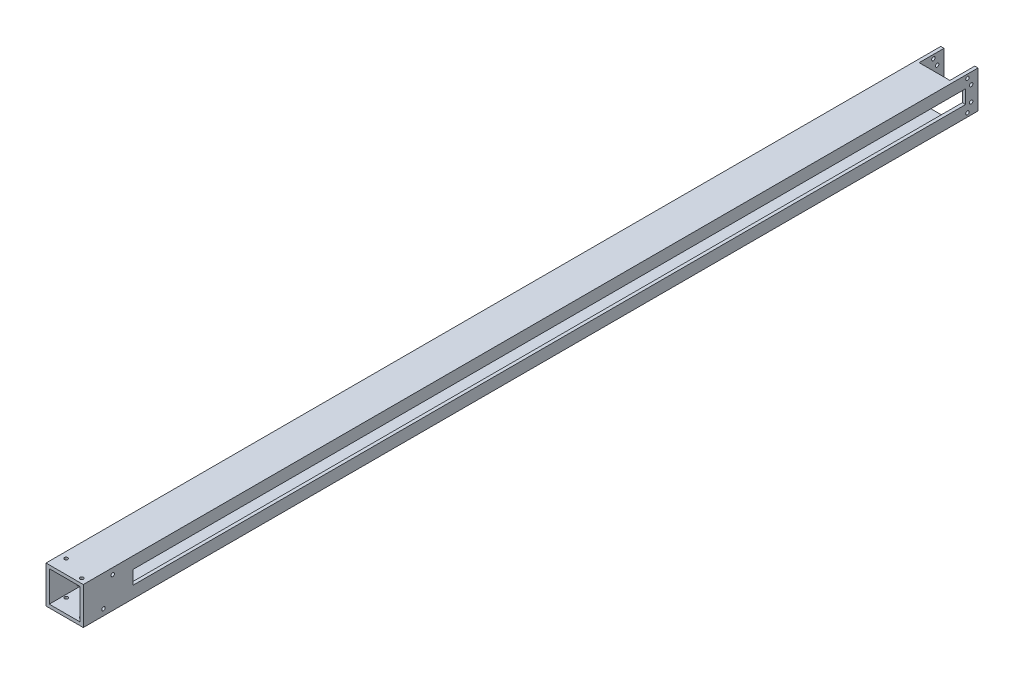
from build123d import *

# Parameters (mm, degrees)
BOSS_EXTRUDE1_DEPTH     = 914.4
CUT_EXTRUDE2_DEPTH      = 70.104
CUT_EXTRUDE2_DEPTH_BACK = 58.42
SKETCH7_R               = 1.75
SKETCH8_W               = 31.4325
SKETCH8_H               = 50.8
CUT_EXTRUDE3_DEPTH      = 71.882
SKETCH10_R              = 1.75
CUT_EXTRUDE5_DEPTH      = 12.7
SKETCH11_W              = 13.97
SKETCH11_H              = 12.7
BOSS_EXTRUDE2_DEPTH     = 3.33375
SKETCH9_R               = 1.75
CUT_EXTRUDE4_DEPTH      = 68.326
CIRPATTERN1_COUNT       = 2
SKETCH12_W              = 38.1
SKETCH12_H              = 50.8
SKETCH12_R              = 1.75
BOSS_EXTRUDE3_DEPTH     = 3.33375


with BuildPart() as part:
    # Sketch1 → Boss-Extrude1 (new body)
    with BuildSketch(Plane(origin=(0, 0, 0), x_dir=(0, 1, 0), z_dir=(0, 0, 1))):
        Polygon((6.985, -19.05), (19.05, -19.05), (19.05, 19.05), (-19.05, 19.05), (-19.05, -19.05), (-6.985, -19.05), (-6.985, -15.71625), (-15.71625, -15.71625), (-15.71625, 15.71625), (15.71625, 15.71625), (15.71625, -15.71625), (6.985, -15.71625), align=None)
    extrude(amount=BOSS_EXTRUDE1_DEPTH)

    # Sketch7 → Cut-Extrude2 (cut, two sides: drawn at the far end of the back side and taken through both)
    with BuildSketch(Plane(origin=(0, 0, 0), x_dir=(-1, 0, 0), z_dir=(0, 1, 0)).offset(-CUT_EXTRUDE2_DEPTH_BACK)):
        with Locations(Location((-12.7, 909.6375, 0), (0, 0, 270))):
            Circle(SKETCH7_R)
        with Locations(Location((12.7, 900.1125, 0), (0, 0, 270))):
            Circle(SKETCH7_R)
    extrude(amount=CUT_EXTRUDE2_DEPTH + CUT_EXTRUDE2_DEPTH_BACK, mode=Mode.SUBTRACT)

    # Sketch8 → Cut-Extrude3 (cut)
    with BuildSketch(Plane(origin=(0, 19.05, 0), x_dir=(-1, 0, 0), z_dir=(0, 1, 0))):
        Rectangle(SKETCH8_W, SKETCH8_H)
    extrude(amount=-CUT_EXTRUDE3_DEPTH, mode=Mode.SUBTRACT)

    # Sketch10 → Cut-Extrude5 (cut)
    with BuildSketch(Plane.YZ.offset(19.05)):
        with Locations((-12.7, 893.7625)):
            Circle(SKETCH10_R)
        with Locations((12.7, 884.2375)):
            Circle(SKETCH10_R)
    cut_extrude5 = extrude(amount=-CUT_EXTRUDE5_DEPTH, mode=Mode.SUBTRACT)

    # Sketch11 → Boss-Extrude2 (add)
    with BuildSketch(Plane.YZ.offset(19.05)):
        with Locations((0, 6.35)):
            Rectangle(SKETCH11_W, SKETCH11_H)
    extrude(amount=-BOSS_EXTRUDE2_DEPTH)

    # Sketch9 → Cut-Extrude4 (cut)
    with BuildSketch(Plane.YZ.offset(19.05)):
        with Locations((-15.24, 10.795)):
            Circle(SKETCH9_R)
        with Locations((15.24, 10.795)):
            Circle(SKETCH9_R)
        with Locations((7.62, 6.985)):
            Circle(SKETCH9_R)
        with Locations((-7.62, 6.985)):
            Circle(SKETCH9_R)
    extrude(amount=-CUT_EXTRUDE4_DEPTH, mode=Mode.SUBTRACT)

    # CirPattern1: Cut-Extrude5 ×2 about axis
    cirpattern1_axis = Axis((0, 0, 746.76), (0, 0, -1))
    for i in range(1, CIRPATTERN1_COUNT):
        add(cut_extrude5.rotate(cirpattern1_axis, i * 360 / CIRPATTERN1_COUNT), mode=Mode.SUBTRACT)

    # Sketch12 → Boss-Extrude3 (add)
    with BuildSketch(Plane.YZ.offset(19.05)):
        with Locations((0, 889)):
            Rectangle(SKETCH12_W, SKETCH12_H)
        with Locations((12.7, 884.2375)):
            Circle(SKETCH12_R, mode=Mode.SUBTRACT)
        with Locations((-12.7, 893.7625)):
            Circle(SKETCH12_R, mode=Mode.SUBTRACT)
    extrude(amount=-BOSS_EXTRUDE3_DEPTH)


solid = part.part
